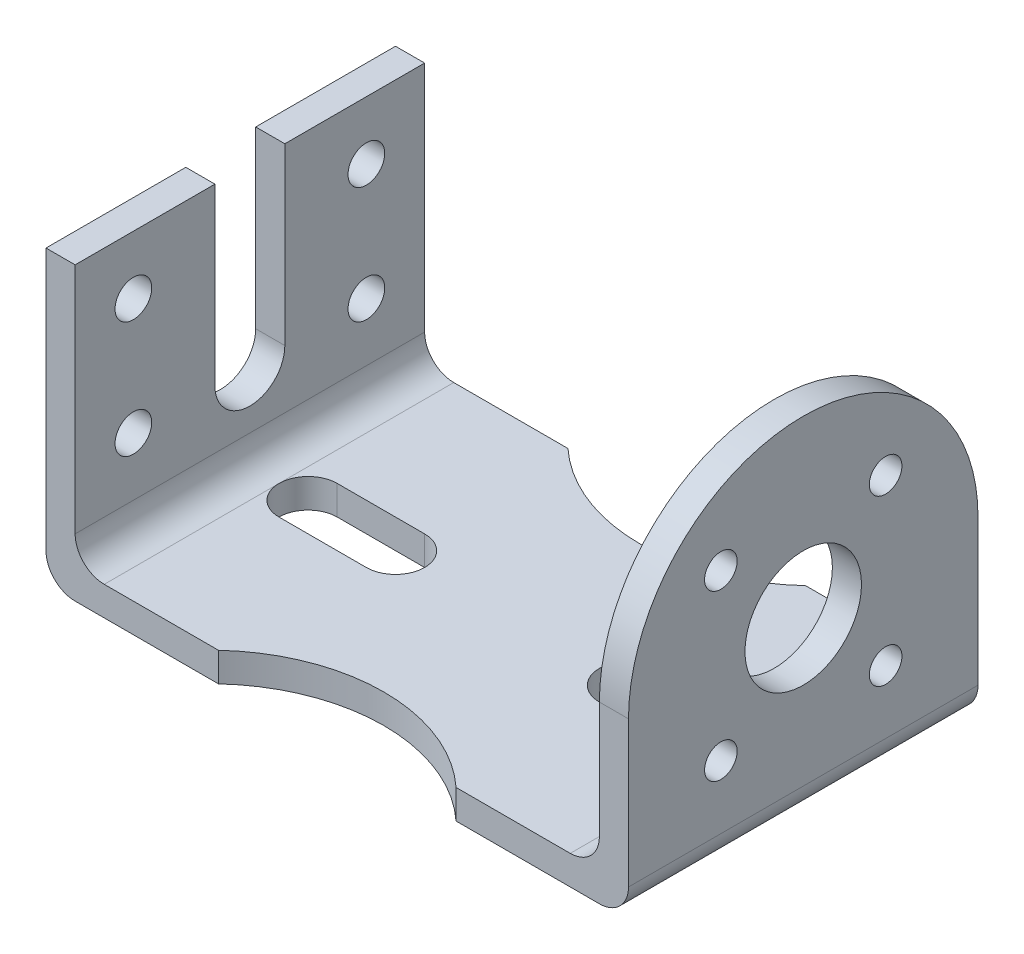
from build123d import *

# Parameters (mm, degrees)
SALIENTE_EXTRUIR1_DEPTH = 5
CROQUIS2_R              = 10.000000000000002
CROQUIS2_R_2            = 2.7999999999999976
CROQUIS2_R_3            = 2.800000000000002
SALIENTE_EXTRUIR2_DEPTH = 5
CROQUIS3_R              = 3.149999999999999
CROQUIS3_R_2            = 3.1499999999999972
SALIENTE_EXTRUIR3_DEPTH = 5
REDONDEO1_R             = 5
REDONDEO2_R             = 5
REDONDEO3_R             = 5
REDONDEO4_R             = 5


with BuildPart() as part:
    # Croquis1 → Saliente-Extruir1 (new body)
    with BuildSketch(Plane(origin=(0, 0, 0), x_dir=(1, 0, 0), z_dir=(0, 1, 0))):
        with BuildLine():
            Line((-46.42082429501085, 21.041214750542295), (-16.81690234938199, 21.041214750542295))
            ThreePointArc((-16.81690234938199, 21.041214750542295), (3.579175704989149, 13.041214750542295), (23.975253759360285, 21.041214750542295))
            Line((23.975253759360285, 21.041214750542295), (53.57917570498915, 21.041214750542295))
            Line((53.57917570498915, 21.041214750542295), (53.57917570498915, -38.9587852494577))
            Line((53.57917570498915, -38.9587852494577), (23.975253759360285, -38.9587852494577))
            ThreePointArc((23.975253759360285, -38.9587852494577), (3.579175704989149, -30.958785249457698), (-16.81690234938199, -38.9587852494577))
            Line((-16.81690234938199, -38.9587852494577), (-46.420824295010846, -38.9587852494577))
            Line((-46.420824295010846, -38.9587852494577), (-46.42082429501085, 21.041214750542295))
        make_face()
        with BuildLine():
            Line((-16.42082429501085, -3.958785249457704), (-31.42082429501085, -3.9587852494577107))
            ThreePointArc((-31.42082429501085, -3.9587852494577107), (-36.420824295010846, -8.958785249457705), (-31.42082429501085, -13.9587852494577))
            Line((-31.42082429501085, -13.9587852494577), (-16.42082429501085, -13.958785249457705))
            ThreePointArc((-16.42082429501085, -13.958785249457705), (-11.42082429501085, -8.958785249457705), (-16.42082429501085, -3.958785249457704))
        make_face(mode=Mode.SUBTRACT)
        with BuildLine():
            Line((23.579175704989144, -13.958785249457705), (38.57917570498914, -13.9587852494577))
            ThreePointArc((38.57917570498914, -13.9587852494577), (43.57917570498913, -8.958785249457705), (38.57917570498914, -3.9587852494577107))
            Line((38.57917570498914, -3.9587852494577107), (23.579175704989144, -3.958785249457704))
            ThreePointArc((23.579175704989144, -3.958785249457704), (18.579175704989144, -8.958785249457705), (23.579175704989144, -13.958785249457705))
        make_face(mode=Mode.SUBTRACT)
    extrude(amount=SALIENTE_EXTRUIR1_DEPTH)

    # Croquis2 → Saliente-Extruir2 (add)
    with BuildSketch(Plane(origin=(53.57917570498915, 0, 0), x_dir=(0, 0, -1), z_dir=(1, 0, 0))):
        with BuildLine():
            Line((-38.9587852494577, 0), (21.0412147505423, 0))
            Line((21.0412147505423, 0), (21.0412147505423, 30))
            ThreePointArc((21.0412147505423, 30), (-8.9587852494577, 60), (-38.9587852494577, 30))
            Line((-38.9587852494577, 30), (-38.9587852494577, 0))
        make_face()
        with Locations((-8.958785249457701, 30)):
            Circle(CROQUIS2_R, mode=Mode.SUBTRACT)
        with Locations((-23.10092087318865, 44.14213562373096)):
            Circle(CROQUIS2_R_2, mode=Mode.SUBTRACT)
        with Locations((-23.100920873188652, 15.85786437626905)):
            Circle(CROQUIS2_R_3, mode=Mode.SUBTRACT)
        with Locations(Location((5.183350374273251, 15.85786437626905, 0), (0, 0, 180))):
            Circle(CROQUIS2_R_3, mode=Mode.SUBTRACT)
        with Locations(Location((5.183350374273248, 44.14213562373096, 0), (0, 0, 180))):
            Circle(CROQUIS2_R_2, mode=Mode.SUBTRACT)
    extrude(amount=-SALIENTE_EXTRUIR2_DEPTH)

    # Croquis3 → Saliente-Extruir3 (add)
    with BuildSketch(Plane.ZY.offset(46.42082429501085)):
        with BuildLine():
            Line((-21.041214750542302, 0), (38.9587852494577, 0))
            Line((38.9587852494577, 0), (38.9587852494577, 50))
            Line((38.9587852494577, 50), (14.958785249457705, 50))
            Line((14.958785249457705, 50), (14.958785249457707, 20.000000000000004))
            ThreePointArc((14.958785249457707, 20.000000000000004), (8.958785249457703, 14.000000000000004), (2.958785249457704, 20.000000000000004))
            Line((2.958785249457704, 20.000000000000004), (2.9587852494577036, 50))
            Line((2.9587852494577036, 50), (-21.041214750542302, 50))
            Line((-21.041214750542302, 50), (-21.041214750542302, 0))
        make_face()
        with Locations((-11.041214750542295, 19.999999999999996)):
            Circle(CROQUIS3_R, mode=Mode.SUBTRACT)
        with Locations((-11.041214750542295, 39.99999999999999)):
            Circle(CROQUIS3_R, mode=Mode.SUBTRACT)
        with Locations(Location((28.958785249457705, 20.000000000000004, 0), (0, 0, 180))):
            Circle(CROQUIS3_R, mode=Mode.SUBTRACT)
        with Locations(Location((28.958785249457698, 40.00000000000001, 0), (0, 0, 180))):
            Circle(CROQUIS3_R_2, mode=Mode.SUBTRACT)
    extrude(amount=-SALIENTE_EXTRUIR3_DEPTH)

    # Redondeo1
    redondeo1_edges = [part.edges().sort_by_distance(p)[0] for p in [
        (-41.42082429501085, 5, 8.9587852494577),
    ]]
    fillet(redondeo1_edges, radius=REDONDEO1_R)

    # Redondeo2
    redondeo2_edges = [part.edges().sort_by_distance(p)[0] for p in [
        (48.57917570498915, 5, 8.958785249457703),
    ]]
    fillet(redondeo2_edges, radius=REDONDEO2_R)

    # Redondeo3
    redondeo3_edges = [part.edges().sort_by_distance(p)[0] for p in [
        (53.57917570498915, 0, 8.958785249457701),
    ]]
    fillet(redondeo3_edges, radius=REDONDEO3_R)

    # Redondeo4
    redondeo4_edges = [part.edges().sort_by_distance(p)[0] for p in [
        (-46.420824295010846, 0, 8.958785249457701),
    ]]
    fillet(redondeo4_edges, radius=REDONDEO4_R)


solid = part.part
